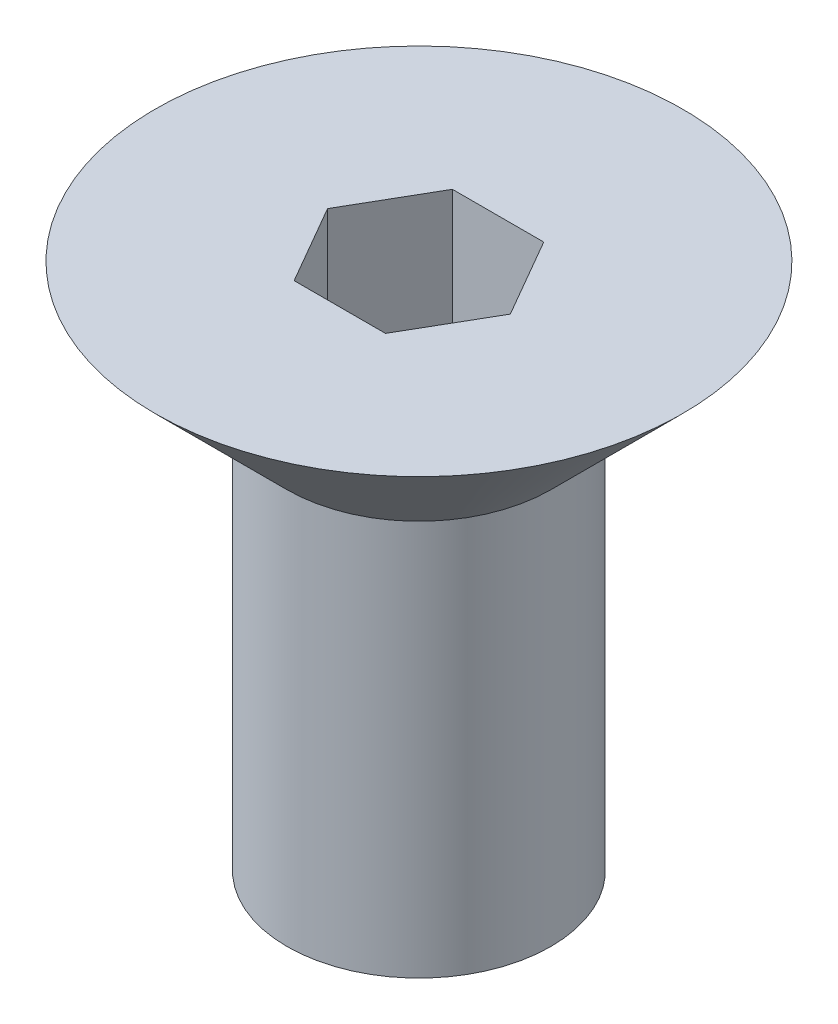
from build123d import *

# Parameters (mm, degrees)
CUT_EXTRUDE1_DEPTH = 2.5


with BuildPart() as part:
    # Sketch1 → Revolve1 (revolve)
    with BuildSketch(Plane.XY, mode=Mode.PRIVATE) as revolve1_sk:
        Polygon((0, -10), (2.5, -10), (2.5, -2.5), (5, 0), (0, 0), align=None)
    revolve(revolve1_sk.sketch.rotate(Axis((0, 61.691642626, 0), (0, -1, 0)), 90), axis=Axis((0, 61.691642626, 0), (0, -1, 0)))

    # Sketch2 → Cut-Extrude1 (cut)
    with BuildSketch(Plane(origin=(0, 0, 0), x_dir=(-1, 0, 0), z_dir=(0, 1, 0))):
        Polygon((-0.866025404, -1.5), (0.866025404, -1.5), (1.732050808, 0), (0.866025404, 1.5), (-0.866025404, 1.5), (-1.732050808, 0), align=None)
    extrude(amount=-CUT_EXTRUDE1_DEPTH, mode=Mode.SUBTRACT)


solid = part.part
